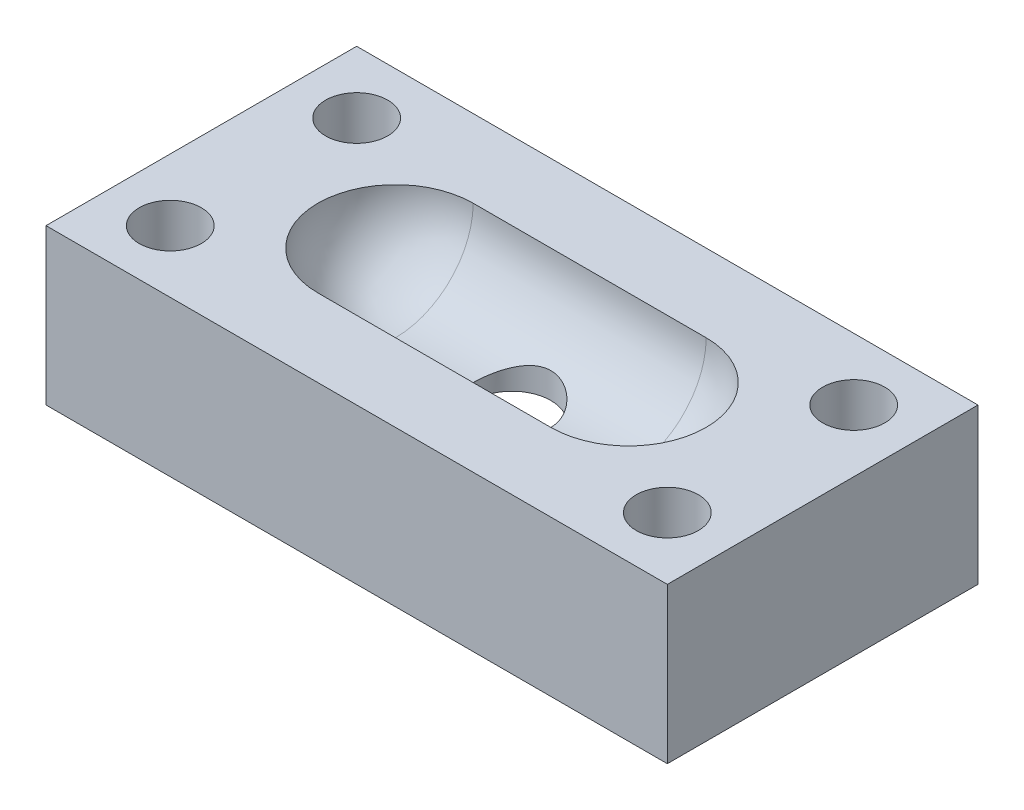
from build123d import *

# Parameters (mm, degrees)
SKETCH1_W           = 40
SKETCH1_H           = 20
SKETCH1_R           = 2
SKETCH1_R_2         = 2.5
BOSS_EXTRUDE1_DEPTH = 5
CHAMFER1_SIZE       = 1
CUT_EXTRUDE1_DEPTH  = 4
FILLET1_R           = 2


with BuildPart() as part:
    # Sketch1 → Boss-Extrude1 (new, symmetric)
    with BuildSketch(Plane(origin=(0, 0, 0), x_dir=(1, 0, 0), z_dir=(0, 1, 0))):
        Rectangle(SKETCH1_W, SKETCH1_H)
        with Locations(Location((-16, 6, 0), (0, 0, 270))):
            Circle(SKETCH1_R, mode=Mode.SUBTRACT)
        with Locations(Location((16, 6, 0), (0, 0, 270))):
            Circle(SKETCH1_R, mode=Mode.SUBTRACT)
        with Locations(Location((16, -6, 0), (0, 0, 270))):
            Circle(SKETCH1_R, mode=Mode.SUBTRACT)
        with Locations(Location((-16, -6, 0), (0, 0, 270))):
            Circle(SKETCH1_R, mode=Mode.SUBTRACT)
        with Locations(Location((0, 0, 0), (0, 0, 270))):
            Circle(SKETCH1_R_2, mode=Mode.SUBTRACT)
    extrude(amount=BOSS_EXTRUDE1_DEPTH, both=True)

    # Sketch2 → Cut-Revolve1 (revolve, cut)
    with BuildSketch(Plane.XY):
        with BuildLine():
            Line((-12.5, 5), (12.5, 5))
            ThreePointArc((12.5, 5), (11.035533906, 1.464466094), (7.5, 0))
            Line((7.5, 0), (-7.5, 0))
            ThreePointArc((-7.5, 0), (-11.035533906, 1.464466094), (-12.5, 5))
        make_face()
    revolve(axis=Axis((-12.5, 5, 0), (1, 0, 0)), mode=Mode.SUBTRACT)

    # Chamfer1
    chamfer1_edges = [part.edges().sort_by_distance(p)[0] for p in [
        (-16, -5, -8),
        (16, -5, -8),
        (16, -5, 4),
        (-16, -5, 4),
    ]]
    chamfer(chamfer1_edges, length=CHAMFER1_SIZE)

    # Sketch3 → Cut-Extrude1 (cut)
    with BuildSketch(Plane.XZ.offset(5)):
        with BuildLine():
            Line((-5.607695155, 7), (5.607695155, 7))
            ThreePointArc((5.607695155, 7), (12.607695155, 0), (5.607695155, -7))
            Line((5.607695155, -7), (-5.607695155, -7))
            ThreePointArc((-5.607695155, -7), (-12.607695155, 0), (-5.607695155, 7))
        make_face()
    extrude(amount=-CUT_EXTRUDE1_DEPTH, mode=Mode.SUBTRACT)

    # Fillet1
    fillet1_edges = [part.edges().sort_by_distance(p)[0] for p in [
        (-12.607695155, -1, 0),
        (0, -1, 7),
        (12.607695155, -1, 0),
        (0, -1, -7),
    ]]
    fillet(fillet1_edges, radius=FILLET1_R)


solid = part.part
